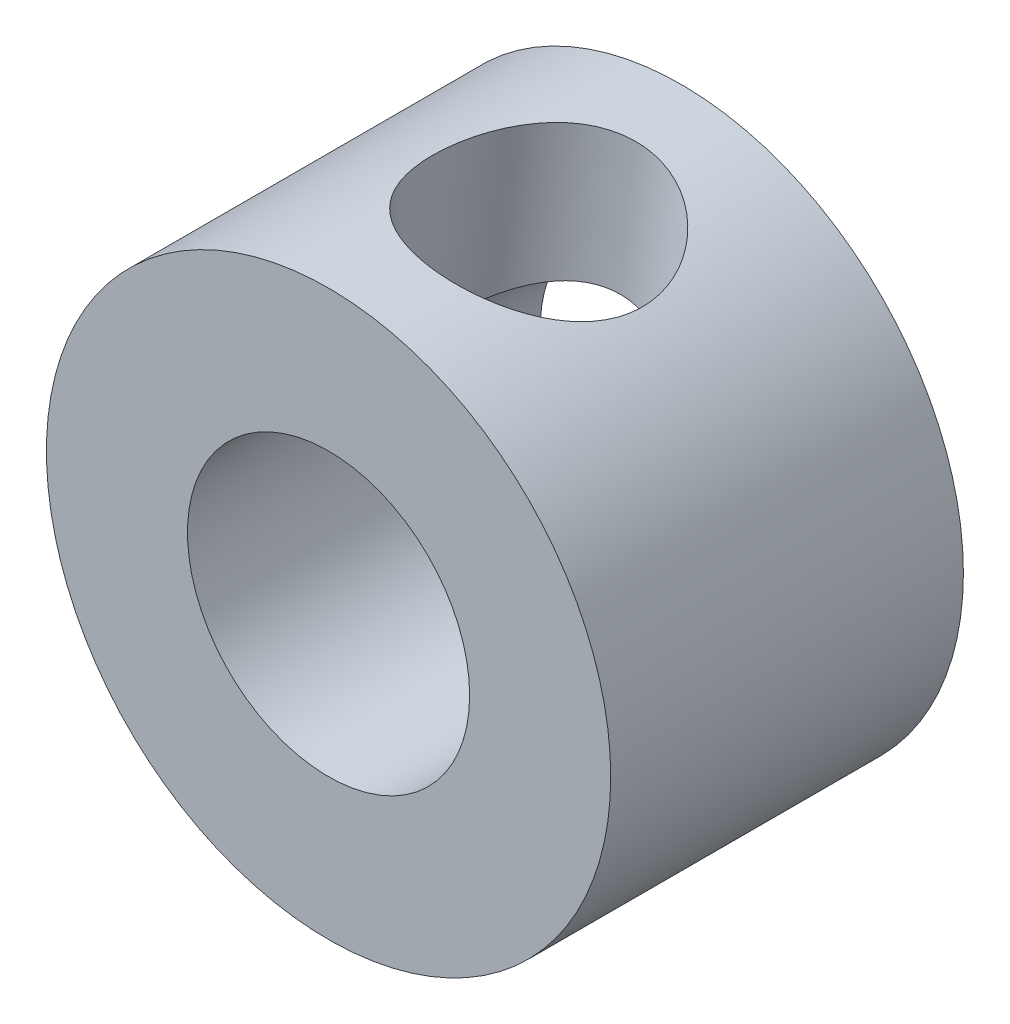
from build123d import *

# Parameters (mm, degrees)
SKETCH_1_R          = 4
EXTRUDE_1_DEPTH     = 5
SKETCH_2_R          = 2
CUT_EXTRUDE_1_DEPTH = 8.549834435
M3X0_5_1_REACH      = 11.486
M3X0_5_1_BORE_R     = 1.5


with BuildPart() as part:
    # ｽｹｯﾁ1 → ﾎﾞｽ - 押し出し1 (new body)
    with BuildSketch(Plane.XY):
        Circle(SKETCH_1_R)
    extrude(amount=EXTRUDE_1_DEPTH)

    # ｽｹｯﾁ2 → ｶｯﾄ - 押し出し1 (cut, through all)
    with BuildSketch(Plane.XY.offset(5)):
        Circle(SKETCH_2_R)
    extrude(amount=-CUT_EXTRUDE_1_DEPTH, mode=Mode.SUBTRACT)

    # M3x0.5 ねじ穴1 bore (on position points) → M3x0.5 ねじ穴1 (cut, up to next)
    with BuildSketch(Plane(origin=(0.497313961, 3.968964452, 2.5), x_dir=(0.992241113083, -0.124328490328, 0), z_dir=(0.124328490328, 0.992241113083, 0)), mode=Mode.PRIVATE) as m3x0_5_1_sk1:
        Circle(M3X0_5_1_BORE_R)
    m3x0_5_1_tool1 = extrude(m3x0_5_1_sk1.sketch, amount=-M3X0_5_1_REACH, mode=Mode.PRIVATE) & part.part
    add(m3x0_5_1_tool1.solids().sort_by_distance((0.497314, 3.968964, 2.5))[0], mode=Mode.SUBTRACT)


solid = part.part
